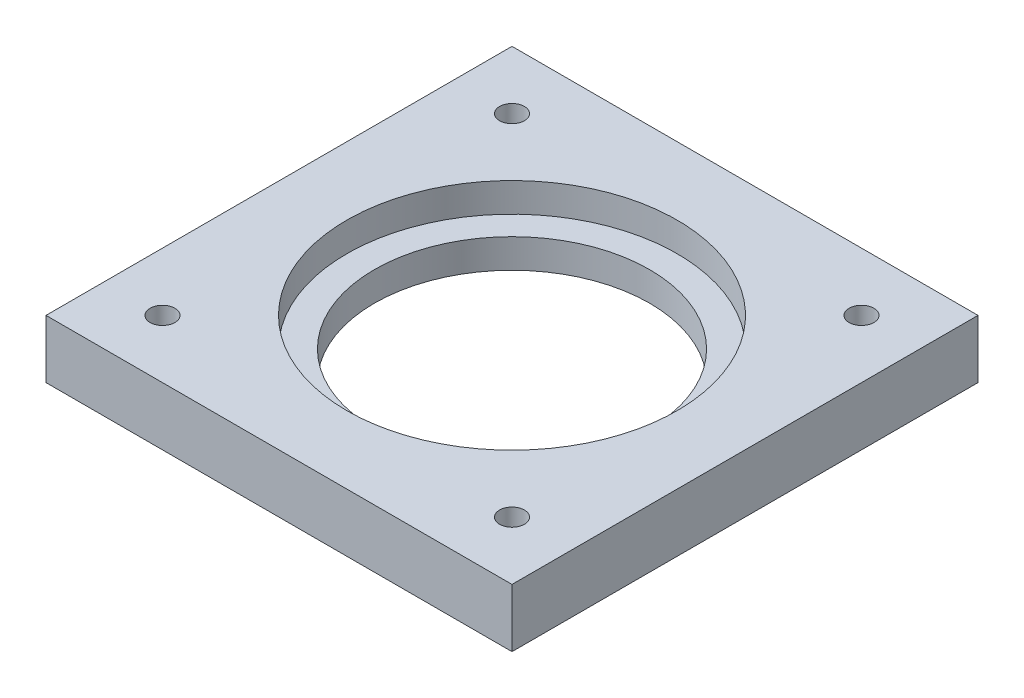
from build123d import *

# Parameters (mm, degrees)
SKETCH2_W                 = 50.8
SKETCH2_H                 = 50.8
BOSS_EXTRUDE1_DEPTH       = 6.35
SKETCH3_R                 = 18
CUT_EXTRUDE1_DEPTH        = 3.175
SKETCH4_R                 = 15
CUT_EXTRUDE2_DEPTH        = 73.122135992
TAP_DRILL_FOR_6_32_TAP1_D = 2.7051


with BuildPart() as part:
    # Sketch2 → Boss-Extrude1 (new body)
    with BuildSketch(Plane(origin=(0, 0, 0), x_dir=(1, 0, 0), z_dir=(0, 1, 0))):
        with Locations((-25.4, 25.4)):
            Rectangle(SKETCH2_W, SKETCH2_H)
    extrude(amount=BOSS_EXTRUDE1_DEPTH)

    # Sketch3 → Cut-Extrude1 (cut)
    with BuildSketch(Plane(origin=(0, 6.35, 0), x_dir=(1, 0, 0), z_dir=(0, 1, 0))):
        with Locations(Location((-25.4, 25.4, 0), (0, 0, 270))):
            Circle(SKETCH3_R)
    extrude(amount=-CUT_EXTRUDE1_DEPTH, mode=Mode.SUBTRACT)

    # Sketch4 → Cut-Extrude2 (cut, through all)
    with BuildSketch(Plane(origin=(0, 0, 0), x_dir=(-1, 0, 0), z_dir=(0, -1, 0))):
        with Locations(Location((25.4, 25.4, 0), (0, 0, 90))):
            Circle(SKETCH4_R)
    extrude(amount=-CUT_EXTRUDE2_DEPTH, mode=Mode.SUBTRACT)

    # Tap Drill for #6-32 Tap1 (through all)
    with Locations(Plane(origin=(0, 0, 0), x_dir=(-1, 0, 0), z_dir=(0, -1, 0))):
        with Locations((6.35, 6.35), (6.35, 44.45), (44.45, 44.45), (44.45, 6.35), (25.4, 25.4)):
            Hole(TAP_DRILL_FOR_6_32_TAP1_D / 2)


solid = part.part
